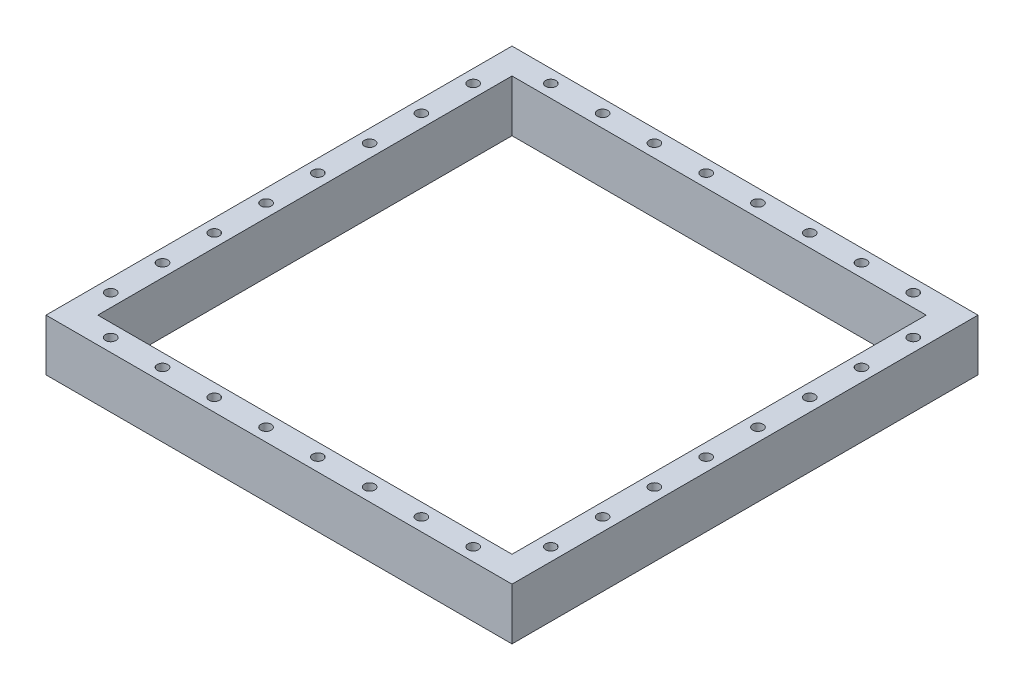
from build123d import *

# Parameters (mm, degrees)
SKETCH1_W                       = 228.6
SKETCH1_H                       = 228.6
SKETCH1_W_2                     = 203.2
SKETCH1_H_2                     = 203.2
BOSS_EXTRUDE1_DEPTH             = 25.4
TAP_DRILL_FOR_1_4_20_TAP1_D     = 5.1054
TAP_DRILL_FOR_1_4_20_TAP1_DEPTH = 12.7
TAP_DRILL_FOR_1_4_20_TAP1_TIP   = 1.533816902


with BuildPart() as part:
    # Sketch1 → Boss-Extrude1 (new body)
    with BuildSketch(Plane(origin=(0, 0, 0), x_dir=(1, 0, 0), z_dir=(0, 1, 0))):
        with Locations((114.3, -114.3)):
            Rectangle(SKETCH1_W, SKETCH1_H)
        with Locations((114.3, -114.3)):
            Rectangle(SKETCH1_W_2, SKETCH1_H_2, mode=Mode.SUBTRACT)
    extrude(amount=BOSS_EXTRUDE1_DEPTH)

    # Tap Drill for 1/4-20 Tap1
    with Locations(Plane(origin=(0, 25.4, 0), x_dir=(1, 0, 0), z_dir=(0, 1, 0))):
        with Locations((25.4, -6.35), (50.8, -6.35), (76.2, -6.35), (101.6, -6.35), (127, -6.35), (152.4, -6.35), (177.8, -6.35), (203.2, -6.35), (6.35, -25.4), (6.35, -50.8), (6.35, -76.2), (6.35, -101.6), (6.35, -127), (6.35, -152.4), (6.35, -177.8), (6.35, -203.2), (222.25, -25.4), (222.25, -50.8), (222.25, -76.2), (222.25, -101.6), (222.25, -127), (222.25, -152.4), (222.25, -177.8), (222.25, -203.2), (25.4, -222.25), (50.8, -222.25), (76.2, -222.25), (101.6, -222.25), (127, -222.25), (152.4, -222.25), (177.8, -222.25), (203.2, -222.25)):
            Hole(TAP_DRILL_FOR_1_4_20_TAP1_D / 2, depth=TAP_DRILL_FOR_1_4_20_TAP1_DEPTH)
            with Locations((0, 0, -(TAP_DRILL_FOR_1_4_20_TAP1_DEPTH + TAP_DRILL_FOR_1_4_20_TAP1_TIP / 2))):  # 118° drill point
                Cone(0, TAP_DRILL_FOR_1_4_20_TAP1_D / 2, TAP_DRILL_FOR_1_4_20_TAP1_TIP, mode=Mode.SUBTRACT)


solid = part.part
